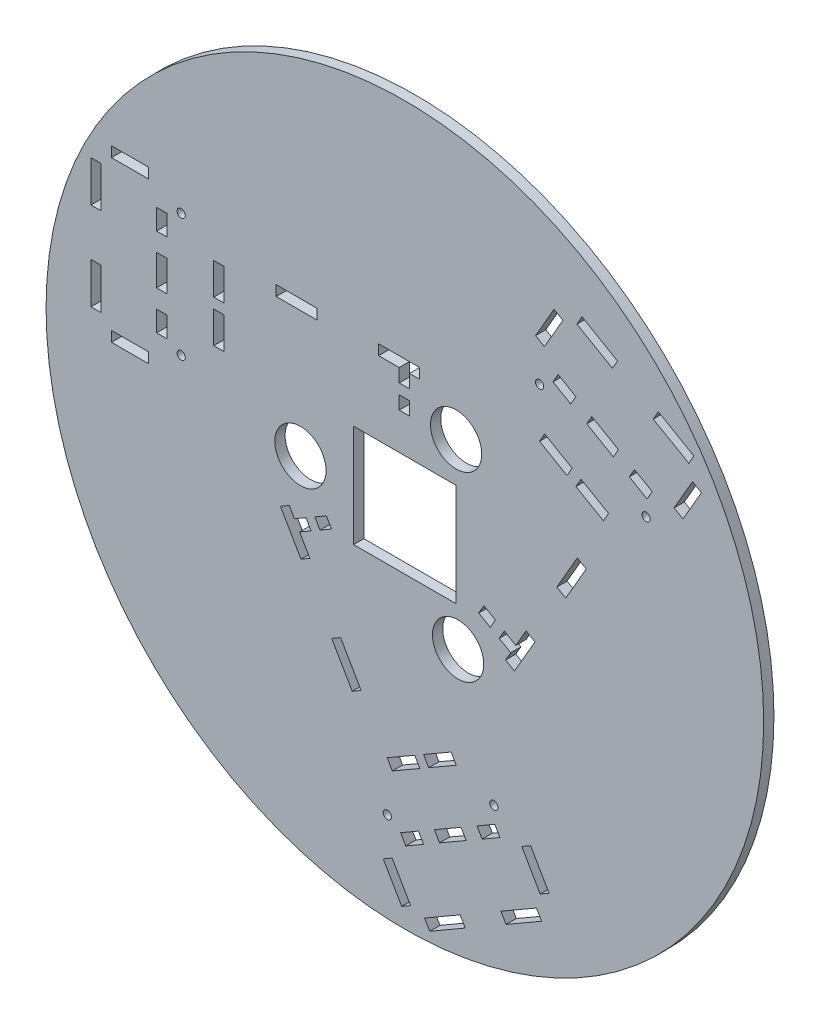
from build123d import *

# Parameters (mm, degrees)
ESQUISSE1_R                = 175
BOSS_EXTRU_1_DEPTH         = 5
ESQUISSE2_W                = 18
ESQUISSE2_H                = 5
ESQUISSE2_W_2              = 5
ESQUISSE2_H_2              = 20
ESQUISSE2_H_3              = 10
ESQUISSE2_H_4              = 15
ESQUISSE2_H_5              = 15.5
ESQUISSE2_W_3              = 20
ESQUISSE2_H_6              = 6.5
ENL_V_MAT_EXTRU_1_DEPTH    = 5
ESQUISSE6_R                = 12.5
ESQUISSE6_W                = 50
ESQUISSE6_H                = 50
ENL_V_MAT_EXTRU_6_DEPTH    = 5
TROUS_DE_CENTRAGE_4_0MM1_D = 4


with BuildPart() as part:
    # Esquisse1 → Boss.-Extru.1 (new body)
    with BuildSketch(Plane.XY):
        with Locations((148.080426897, -12.110171348)):
            Circle(ESQUISSE1_R)
    extrude(amount=BOSS_EXTRU_1_DEPTH)

    # Esquisse2 → Enlèv. mat.-Extru.1 (cut)
    with BuildSketch(Plane.XY.offset(5)):
        Polygon((135.311788567, 53.777441362), (135.311788567, 48.777441362), (145.311788567, 48.777441362), (145.311788567, 42.277441362), (150.311788567, 42.277441362), (150.311788567, 48.777441362), (155.311788567, 48.777441362), (155.311788567, 53.777441362), align=None)
        with Locations((14, 69.777441362)):
            Rectangle(ESQUISSE2_W, ESQUISSE2_H)
        with Locations((-2.5, 52.277441362)):
            Rectangle(ESQUISSE2_W_2, ESQUISSE2_H_2)
        with Locations((-2.5, 9.277441362)):
            Rectangle(ESQUISSE2_W_2, ESQUISSE2_H_2)
        with Locations((14, -8.222558638)):
            Rectangle(ESQUISSE2_W, ESQUISSE2_H)
        with Locations((29.5, 9.277441362)):
            Rectangle(ESQUISSE2_W_2, ESQUISSE2_H_3)
        with Locations((29.5, 30.777441362)):
            Rectangle(ESQUISSE2_W_2, ESQUISSE2_H_4)
        with Locations((29.5, 52.277441362)):
            Rectangle(ESQUISSE2_W_2, ESQUISSE2_H_3)
        with Locations((57.36, 41.027441362)):
            Rectangle(ESQUISSE2_W_2, ESQUISSE2_H_5)
        with Locations((57.36, 20.527441362)):
            Rectangle(ESQUISSE2_W_2, ESQUISSE2_H_5)
        with Locations((95.311788567, 51.277441362)):
            Rectangle(ESQUISSE2_W_3, ESQUISSE2_H)
        with Locations((147.811788567, 34.027441362)):
            Rectangle(ESQUISSE2_W_2, ESQUISSE2_H_6)
        Polygon((292.702456717, 69.607306773), (283.702456717, 54.018849505), (279.372329698, 56.518849505), (288.372329698, 72.107306773), align=None)
        Polygon((289.042202679, 83.267560811), (286.542202679, 78.937433792), (269.221694603, 88.937433792), (271.721694603, 93.267560811), align=None)
        Polygon((251.803110316, 104.767560811), (249.303110316, 100.437433792), (231.982602241, 110.437433792), (234.482602241, 114.767560811), align=None)
        Polygon((225.152475222, 108.607306773), (216.152475222, 93.018849505), (211.822348203, 95.518849505), (220.822348203, 111.107306773), align=None)
        Polygon((231.472983297, 79.55474789), (228.972983297, 75.224620871), (220.31272926, 80.224620871), (222.81272926, 84.55474789), align=None)
        Polygon((252.257592988, 67.55474789), (249.757592988, 63.224620871), (236.767211932, 70.724620871), (239.267211932, 75.05474789), align=None)
        Polygon((268.71207566, 58.05474789), (266.21207566, 53.724620871), (257.551821622, 58.724620871), (260.051821622, 63.05474789), align=None)
        Polygon((247.420859728, 38.17728014), (244.920859728, 33.847153121), (231.497465969, 41.597153121), (233.997465969, 45.92728014), align=None)
        Polygon((229.66733895, 48.42728014), (227.16733895, 44.097153121), (213.743945192, 51.847153121), (216.243945192, 56.17728014), align=None)
        Polygon((211.525092463, -33.996012539), (207.194965444, -31.496012539), (202.194965444, -40.156266577), (196.56580032, -36.906266577), (194.06580032, -41.236393596), (199.694965444, -44.486393596), (197.194965444, -48.816520615), (201.525092463, -51.316520615), align=None)
        Polygon((236.525092463, 9.30525765), (226.525092463, -8.015250425), (222.194965444, -5.515250425), (232.194965444, 11.80525765), align=None)
        Polygon((192.235673301, -34.406266577), (189.735673301, -38.736393596), (184.106508176, -35.486393596), (186.606508176, -31.156266577), align=None)
        Polygon((146.538823973, -178.215262181), (137.538823973, -162.626804912), (141.868950992, -160.126804912), (150.868950992, -175.715262181), align=None)
        Polygon((160.199078011, -181.875516218), (157.699078011, -177.545389199), (175.019586086, -167.545389199), (177.519586086, -171.875516218), align=None)
        Polygon((197.438170373, -160.375516218), (194.938170373, -156.045389199), (212.258678449, -146.045389199), (214.758678449, -150.375516218), align=None)
        Polygon((214.088805468, -139.215262181), (205.088805468, -123.626804912), (209.418932487, -121.126804912), (218.418932487, -136.715262181), align=None)
        Polygon((185.768297392, -130.162703297), (183.268297392, -125.832576278), (191.92855143, -120.832576278), (194.42855143, -125.162703297), align=None)
        Polygon((164.983687701, -142.162703297), (162.483687701, -137.832576278), (175.474068758, -130.332576278), (177.974068758, -134.662703297), align=None)
        Polygon((148.52920503, -151.662703297), (146.02920503, -147.332576278), (154.689459067, -142.332576278), (157.189459067, -146.662703297), align=None)
        Polygon((141.960420962, -123.285235548), (139.460420962, -118.955108529), (152.88381472, -111.205108529), (155.38381472, -115.535235548), align=None)
        Polygon((159.713941739, -113.035235548), (157.213941739, -108.705108529), (170.637335498, -100.955108529), (173.137335498, -105.285235548), align=None)
        Polygon((97.404399659, -56.111942869), (101.734526678, -53.611942869), (96.734526678, -44.951688831), (102.363691803, -41.701688831), (99.863691803, -37.371561812), (94.234526678, -40.621561812), (91.734526678, -36.291434793), (87.404399659, -38.791434793), align=None)
        Polygon((122.404399659, -99.413213058), (112.404399659, -82.092704982), (116.734526678, -79.592704982), (126.734526678, -96.913213058), align=None)
        Polygon((106.693818822, -39.201688831), (104.193818822, -34.871561812), (109.822983946, -31.621561812), (112.322983946, -35.951688831), align=None)
    extrude(amount=-ENL_V_MAT_EXTRU_1_DEPTH, mode=Mode.SUBTRACT)

    # Esquisse6 → Enlèv. mat.-Extru.6 (cut)
    with BuildSketch(Plane.XY.offset(5)):
        with Locations((173.06, 32.277441362)):
            Circle(ESQUISSE6_R)
        with Locations((174.031440566, -55.936922587)):
            Circle(ESQUISSE6_R)
        with Locations((97.149840124, -12.67103282)):
            Circle(ESQUISSE6_R)
        with Locations((148.080426897, -12.110171348)):
            Rectangle(ESQUISSE6_W, ESQUISSE6_H)
    extrude(amount=-ENL_V_MAT_EXTRU_6_DEPTH, mode=Mode.SUBTRACT)

    # Trous de centrage Ø4.0mm1 (through all)
    with Locations(Plane(origin=(148.080426897, -12.110171348, -78), x_dir=(1, 0, 0), z_dir=(0, 0, -1))):
        with Locations((65.70121345, -88.022614393), (117.662737677, -58.022614393), (-109.080426897, -72.887612711), (-109.080426897, -12.887612711), (-8.58231078, 130.910227103), (43.379213447, 100.910227103)):
            Hole(TROUS_DE_CENTRAGE_4_0MM1_D / 2)


solid = part.part
